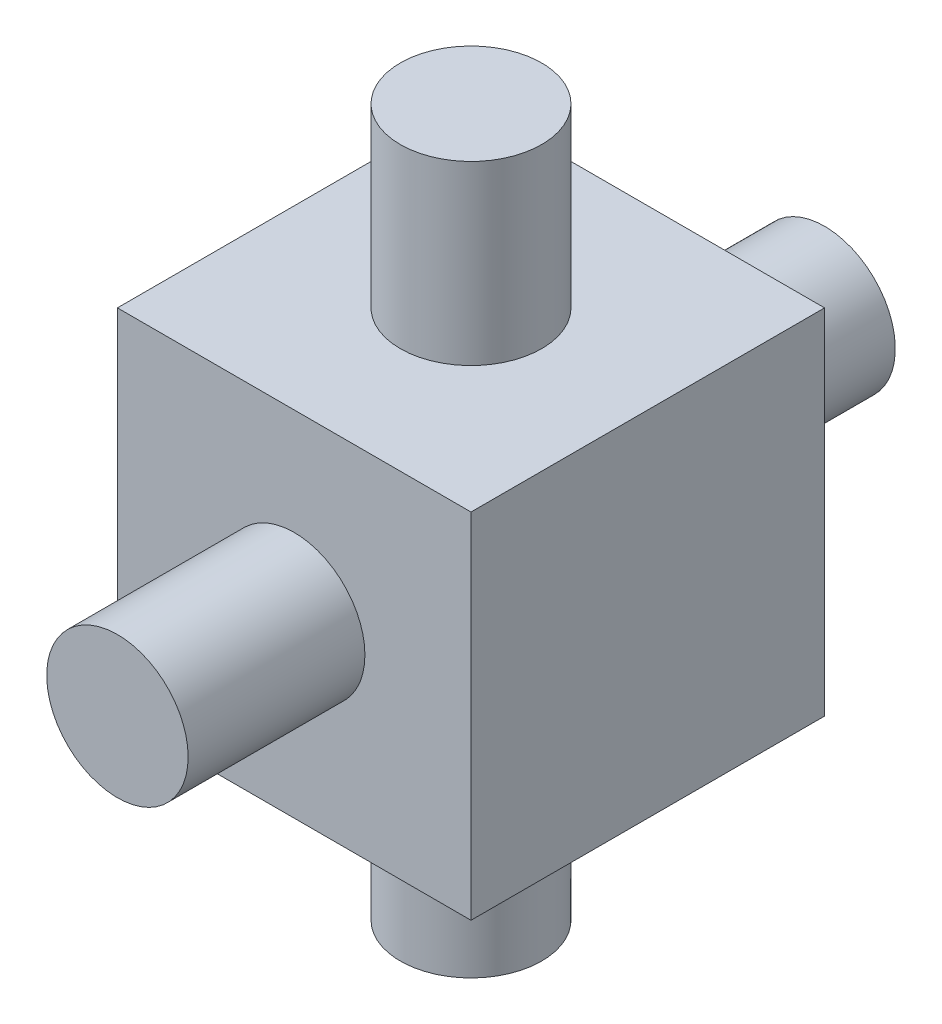
from build123d import *

# Parameters (mm, degrees)
SKETCH2_W           = 20
SKETCH2_H           = 20
BOSS_EXTRUDE1_DEPTH = 10
SKETCH5_R           = 4
BOSS_EXTRUDE2_DEPTH = 10
SKETCH3_R           = 4
BOSS_EXTRUDE3_DEPTH = 10
BOSS_EXTRUDE4_START = 10
SKETCH6_R           = 4
BOSS_EXTRUDE4_DEPTH = 10
BOSS_EXTRUDE5_START = 10
SKETCH4_R           = 4
BOSS_EXTRUDE5_DEPTH = 10


with BuildPart() as part:
    # Sketch2 → Boss-Extrude1 (new, symmetric)
    with BuildSketch(Plane(origin=(0, 0, 0), x_dir=(1, 0, 0), z_dir=(0, 1, 0))):
        Rectangle(SKETCH2_W, SKETCH2_H)
    extrude(amount=BOSS_EXTRUDE1_DEPTH, both=True)

    # Sketch5 → Boss-Extrude2 (add)
    with BuildSketch(Plane(origin=(0, 0, -10), x_dir=(-1, 0, 0), z_dir=(0, 0, -1))):
        Circle(SKETCH5_R)
    extrude(amount=BOSS_EXTRUDE2_DEPTH)

    # Sketch3 → Boss-Extrude3 (add)
    with BuildSketch(Plane(origin=(0, 10, 0), x_dir=(1, 0, 0), z_dir=(0, 1, 0))):
        with Locations(Location((0, 0, 0), (0, 0, 270))):
            Circle(SKETCH3_R)
    extrude(amount=BOSS_EXTRUDE3_DEPTH)

    # Sketch6 → Boss-Extrude4 (add)
    with BuildSketch(Plane.XY.offset(10).offset(BOSS_EXTRUDE4_START)):
        with Locations(Location((0, 0, 0), (0, 0, 180))):
            Circle(SKETCH6_R)
    extrude(amount=-BOSS_EXTRUDE4_DEPTH)

    # Sketch4 → Boss-Extrude5 (add)
    with BuildSketch(Plane.XZ.offset(10).offset(BOSS_EXTRUDE5_START)):
        with Locations(Location((0, 0, 0), (0, 0, 90))):
            Circle(SKETCH4_R)
    extrude(amount=-BOSS_EXTRUDE5_DEPTH)


solid = part.part
